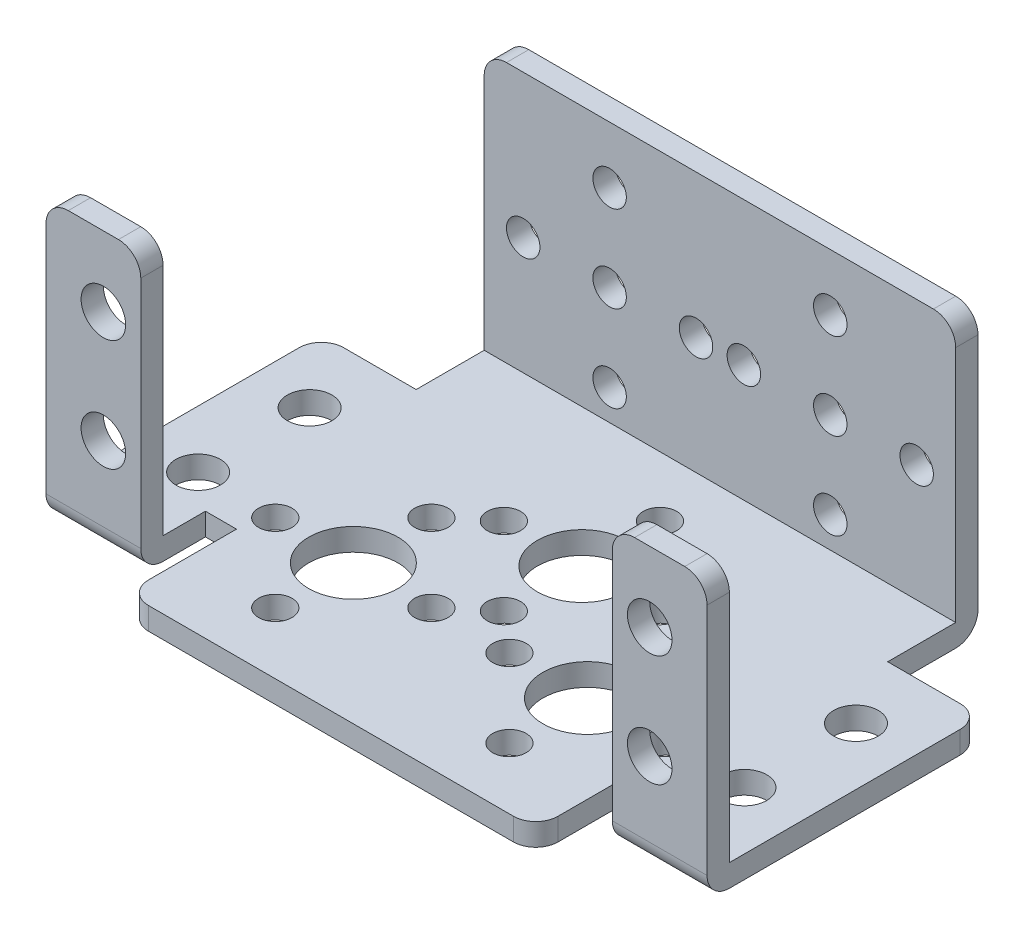
from build123d import *

# Parameters (mm, degrees)
EXTRUDE_1_DEPTH             = 2
EXTRUDE_2_REACH             = 44.559
SKETCH_2_W                  = 2
SKETCH_2_H                  = 23.35
EXTRUDE_2_DIRECTION_2_REACH = 44.559
EXTRUDE_3_DEPTH             = 8.5
CUT_EXTRUDE_1_REACH         = 55.68
SKETCH_4_R                  = 1.5
SKETCH_4_R_2                = 4
SKETCH_4_R_3                = 2
FILLET_1_R                  = 2
CUT_EXTRUDE_2_REACH         = 52.964
SKETCH_5_R                  = 2
SKETCH_6_R                  = 1.5
CUT_EXTRUDE_3_DEPTH         = 53.326503084


with BuildPart() as part:
    # 草图1 → 凸台-拉伸1 (new body)
    with BuildSketch(Plane(origin=(0, 0, 0), x_dir=(1, 0, 0), z_dir=(0, 1, 0))):
        Polygon((21.145, 0), (-21.145, 0), (-21.145, -27), (-18.36, -27), (-18.36, -36.88), (18.36, -36.88), (18.36, -27), (21.145, -27), align=None)
    extrude(amount=EXTRUDE_1_DEPTH)

    # 凸台-拉伸2: up to this face of the body (flat: up to its plane)
    extrude_2_end = Plane(part.part.faces().sort_by_distance((21.145, 1, 13.5))[0])
    # 草图2 → 凸台-拉伸2 (add, up to the picked face)
    with BuildSketch(Plane(origin=(0, 0, 0), x_dir=(0, 0, -1), z_dir=(1, 0, 0)), mode=Mode.PRIVATE) as extrude_2_sk1:
        with Locations((-1, 13.675)):
            Rectangle(SKETCH_2_W, SKETCH_2_H)
    extrude_2_tool1 = split(extrude(extrude_2_sk1.sketch, amount=EXTRUDE_2_REACH, mode=Mode.PRIVATE), bisect_by=extrude_2_end, keep=Keep.BOTH, mode=Mode.PRIVATE)
    add(extrude_2_tool1.solids().sort_by(Axis((0, 13.675, 1), (1, 0, 0)))[0])

    # 凸台-拉伸2 direction 2: up to this face of the body (flat: up to its plane)
    extrude_2_direction_2_end = Plane(part.part.faces().sort_by_distance((-21.145, 1, 13.5))[0])
    # 草图2 → 凸台-拉伸2 direction 2 (add, up to the picked face)
    with BuildSketch(Plane(origin=(0, 0, 0), x_dir=(0, 0, -1), z_dir=(1, 0, 0)), mode=Mode.PRIVATE) as extrude_2_direction_2_sk1:
        with Locations((-1, 13.675)):
            Rectangle(SKETCH_2_W, SKETCH_2_H)
    extrude_2_direction_2_tool1 = split(extrude(extrude_2_direction_2_sk1.sketch, amount=-EXTRUDE_2_DIRECTION_2_REACH, mode=Mode.PRIVATE), bisect_by=extrude_2_direction_2_end, keep=Keep.BOTH, mode=Mode.PRIVATE)
    add(extrude_2_direction_2_tool1.solids().sort_by(Axis((0, 13.675, 1), (-1, 0, 0)))[0])

    # 草图3 → 凸台-拉伸3 (add)
    with BuildSketch(Plane.ZY.offset(21.145)):
        Polygon((32.8, 25), (32.8, 0), (8.1, 0), (8.1, 2), (30.8, 2), (30.8, 25), align=None)
    extrude_3 = extrude(amount=EXTRUDE_3_DEPTH)

    # 镜向1: 凸台-拉伸3 across plane
    add(extrude_3.mirror(Plane(origin=(0, 0, 0), x_dir=(0, 0, 1), z_dir=(1, 0, 0))))

    # 草图4 → 切除-拉伸1 (cut, up to next)
    with BuildSketch(Plane.XZ, mode=Mode.PRIVATE) as cut_extrude_1_sk1:
        with Locations(Location((10.5, 31.38, 0), (0, 0, 270))):
            Circle(SKETCH_4_R)
    cut_extrude_1_tool1 = extrude(cut_extrude_1_sk1.sketch, amount=-CUT_EXTRUDE_1_REACH, mode=Mode.PRIVATE) & part.part
    # 草图4 → 切除-拉伸1 (cut, up to next)
    with BuildSketch(Plane.XZ, mode=Mode.PRIVATE) as cut_extrude_1_sk2:
        with Locations(Location((17.5, 24.38, 0), (0, 0, 270))):
            Circle(SKETCH_4_R)
    cut_extrude_1_tool2 = extrude(cut_extrude_1_sk2.sketch, amount=-CUT_EXTRUDE_1_REACH, mode=Mode.PRIVATE) & part.part
    # 草图4 → 切除-拉伸1 (cut, up to next)
    with BuildSketch(Plane.XZ, mode=Mode.PRIVATE) as cut_extrude_1_sk3:
        with Locations(Location((10.5, 17.38, 0), (0, 0, 270))):
            Circle(SKETCH_4_R)
    cut_extrude_1_tool3 = extrude(cut_extrude_1_sk3.sketch, amount=-CUT_EXTRUDE_1_REACH, mode=Mode.PRIVATE) & part.part
    # 草图4 → 切除-拉伸1 (cut, up to next)
    with BuildSketch(Plane.XZ, mode=Mode.PRIVATE) as cut_extrude_1_sk4:
        with Locations(Location((3.5, 24.38, 0), (0, 0, 270))):
            Circle(SKETCH_4_R)
    cut_extrude_1_tool4 = extrude(cut_extrude_1_sk4.sketch, amount=-CUT_EXTRUDE_1_REACH, mode=Mode.PRIVATE) & part.part
    # 草图4 → 切除-拉伸1 (cut, up to next)
    with BuildSketch(Plane.XZ, mode=Mode.PRIVATE) as cut_extrude_1_sk5:
        with Locations(Location((-17.5, 24.38, 0), (0, 0, 90))):
            Circle(SKETCH_4_R)
    cut_extrude_1_tool5 = extrude(cut_extrude_1_sk5.sketch, amount=-CUT_EXTRUDE_1_REACH, mode=Mode.PRIVATE) & part.part
    # 草图4 → 切除-拉伸1 (cut, up to next)
    with BuildSketch(Plane.XZ, mode=Mode.PRIVATE) as cut_extrude_1_sk6:
        with Locations(Location((-10.5, 17.38, 0), (0, 0, 90))):
            Circle(SKETCH_4_R)
    cut_extrude_1_tool6 = extrude(cut_extrude_1_sk6.sketch, amount=-CUT_EXTRUDE_1_REACH, mode=Mode.PRIVATE) & part.part
    # 草图4 → 切除-拉伸1 (cut, up to next)
    with BuildSketch(Plane.XZ, mode=Mode.PRIVATE) as cut_extrude_1_sk7:
        with Locations(Location((-3.5, 24.38, 0), (0, 0, 90))):
            Circle(SKETCH_4_R)
    cut_extrude_1_tool7 = extrude(cut_extrude_1_sk7.sketch, amount=-CUT_EXTRUDE_1_REACH, mode=Mode.PRIVATE) & part.part
    # 草图4 → 切除-拉伸1 (cut, up to next)
    with BuildSketch(Plane.XZ, mode=Mode.PRIVATE) as cut_extrude_1_sk8:
        with Locations(Location((-10.5, 31.38, 0), (0, 0, 90))):
            Circle(SKETCH_4_R)
    cut_extrude_1_tool8 = extrude(cut_extrude_1_sk8.sketch, amount=-CUT_EXTRUDE_1_REACH, mode=Mode.PRIVATE) & part.part
    # 草图4 → 切除-拉伸1 (cut, up to next)
    with BuildSketch(Plane.XZ, mode=Mode.PRIVATE) as cut_extrude_1_sk9:
        with Locations(Location((0, 21.38, 0), (0, 0, 270))):
            Circle(SKETCH_4_R)
    cut_extrude_1_tool9 = extrude(cut_extrude_1_sk9.sketch, amount=-CUT_EXTRUDE_1_REACH, mode=Mode.PRIVATE) & part.part
    # 草图4 → 切除-拉伸1 (cut, up to next)
    with BuildSketch(Plane.XZ, mode=Mode.PRIVATE) as cut_extrude_1_sk10:
        with Locations(Location((7, 14.38, 0), (0, 0, 270))):
            Circle(SKETCH_4_R)
    cut_extrude_1_tool10 = extrude(cut_extrude_1_sk10.sketch, amount=-CUT_EXTRUDE_1_REACH, mode=Mode.PRIVATE) & part.part
    # 草图4 → 切除-拉伸1 (cut, up to next)
    with BuildSketch(Plane.XZ, mode=Mode.PRIVATE) as cut_extrude_1_sk11:
        with Locations(Location((0, 7.38, 0), (0, 0, 270))):
            Circle(SKETCH_4_R)
    cut_extrude_1_tool11 = extrude(cut_extrude_1_sk11.sketch, amount=-CUT_EXTRUDE_1_REACH, mode=Mode.PRIVATE) & part.part
    # 草图4 → 切除-拉伸1 (cut, up to next)
    with BuildSketch(Plane.XZ, mode=Mode.PRIVATE) as cut_extrude_1_sk12:
        with Locations(Location((-7, 14.38, 0), (0, 0, 270))):
            Circle(SKETCH_4_R)
    cut_extrude_1_tool12 = extrude(cut_extrude_1_sk12.sketch, amount=-CUT_EXTRUDE_1_REACH, mode=Mode.PRIVATE) & part.part
    # 草图4 → 切除-拉伸1 (cut, up to next)
    with BuildSketch(Plane.XZ, mode=Mode.PRIVATE) as cut_extrude_1_sk13:
        with Locations(Location((10.5, 24.38, 0), (0, 0, 270))):
            Circle(SKETCH_4_R_2)
    cut_extrude_1_tool13 = extrude(cut_extrude_1_sk13.sketch, amount=-CUT_EXTRUDE_1_REACH, mode=Mode.PRIVATE) & part.part
    # 草图4 → 切除-拉伸1 (cut, up to next)
    with BuildSketch(Plane.XZ, mode=Mode.PRIVATE) as cut_extrude_1_sk14:
        with Locations(Location((-10.5, 24.38, 0), (0, 0, 90))):
            Circle(SKETCH_4_R_2)
    cut_extrude_1_tool14 = extrude(cut_extrude_1_sk14.sketch, amount=-CUT_EXTRUDE_1_REACH, mode=Mode.PRIVATE) & part.part
    # 草图4 → 切除-拉伸1 (cut, up to next)
    with BuildSketch(Plane.XZ, mode=Mode.PRIVATE) as cut_extrude_1_sk15:
        with Locations(Location((0, 14.38, 0), (0, 0, 270))):
            Circle(SKETCH_4_R_2)
    cut_extrude_1_tool15 = extrude(cut_extrude_1_sk15.sketch, amount=-CUT_EXTRUDE_1_REACH, mode=Mode.PRIVATE) & part.part
    # 草图4 → 切除-拉伸1 (cut, up to next)
    with BuildSketch(Plane.XZ, mode=Mode.PRIVATE) as cut_extrude_1_sk16:
        with Locations(Location((24.5, 24.3, 0), (0, 0, 270))):
            Circle(SKETCH_4_R_3)
    cut_extrude_1_tool16 = extrude(cut_extrude_1_sk16.sketch, amount=-CUT_EXTRUDE_1_REACH, mode=Mode.PRIVATE) & part.part
    # 草图4 → 切除-拉伸1 (cut, up to next)
    with BuildSketch(Plane.XZ, mode=Mode.PRIVATE) as cut_extrude_1_sk17:
        with Locations(Location((24.5, 14.3, 0), (0, 0, 270))):
            Circle(SKETCH_4_R_3)
    cut_extrude_1_tool17 = extrude(cut_extrude_1_sk17.sketch, amount=-CUT_EXTRUDE_1_REACH, mode=Mode.PRIVATE) & part.part
    # 草图4 → 切除-拉伸1 (cut, up to next)
    with BuildSketch(Plane.XZ, mode=Mode.PRIVATE) as cut_extrude_1_sk18:
        with Locations(Location((-24.5, 14.3, 0), (0, 0, 90))):
            Circle(SKETCH_4_R_3)
    cut_extrude_1_tool18 = extrude(cut_extrude_1_sk18.sketch, amount=-CUT_EXTRUDE_1_REACH, mode=Mode.PRIVATE) & part.part
    # 草图4 → 切除-拉伸1 (cut, up to next)
    with BuildSketch(Plane.XZ, mode=Mode.PRIVATE) as cut_extrude_1_sk19:
        with Locations(Location((-24.5, 24.3, 0), (0, 0, 90))):
            Circle(SKETCH_4_R_3)
    cut_extrude_1_tool19 = extrude(cut_extrude_1_sk19.sketch, amount=-CUT_EXTRUDE_1_REACH, mode=Mode.PRIVATE) & part.part
    add(cut_extrude_1_tool1.solids().sort_by_distance((10.5, 0, 31.38))[0], mode=Mode.SUBTRACT)
    add(cut_extrude_1_tool2.solids().sort_by_distance((17.5, 0, 24.38))[0], mode=Mode.SUBTRACT)
    add(cut_extrude_1_tool3.solids().sort_by_distance((10.5, 0, 17.38))[0], mode=Mode.SUBTRACT)
    add(cut_extrude_1_tool4.solids().sort_by_distance((3.5, 0, 24.38))[0], mode=Mode.SUBTRACT)
    add(cut_extrude_1_tool5.solids().sort_by_distance((-17.5, 0, 24.38))[0], mode=Mode.SUBTRACT)
    add(cut_extrude_1_tool6.solids().sort_by_distance((-10.5, 0, 17.38))[0], mode=Mode.SUBTRACT)
    add(cut_extrude_1_tool7.solids().sort_by_distance((-3.5, 0, 24.38))[0], mode=Mode.SUBTRACT)
    add(cut_extrude_1_tool8.solids().sort_by_distance((-10.5, 0, 31.38))[0], mode=Mode.SUBTRACT)
    add(cut_extrude_1_tool9.solids().sort_by_distance((0, 0, 21.38))[0], mode=Mode.SUBTRACT)
    add(cut_extrude_1_tool10.solids().sort_by_distance((7, 0, 14.38))[0], mode=Mode.SUBTRACT)
    add(cut_extrude_1_tool11.solids().sort_by_distance((0, 0, 7.38))[0], mode=Mode.SUBTRACT)
    add(cut_extrude_1_tool12.solids().sort_by_distance((-7, 0, 14.38))[0], mode=Mode.SUBTRACT)
    add(cut_extrude_1_tool13.solids().sort_by_distance((10.5, 0, 24.38))[0], mode=Mode.SUBTRACT)
    add(cut_extrude_1_tool14.solids().sort_by_distance((-10.5, 0, 24.38))[0], mode=Mode.SUBTRACT)
    add(cut_extrude_1_tool15.solids().sort_by_distance((0, 0, 14.38))[0], mode=Mode.SUBTRACT)
    add(cut_extrude_1_tool16.solids().sort_by_distance((24.5, 0, 24.3))[0], mode=Mode.SUBTRACT)
    add(cut_extrude_1_tool17.solids().sort_by_distance((24.5, 0, 14.3))[0], mode=Mode.SUBTRACT)
    add(cut_extrude_1_tool18.solids().sort_by_distance((-24.5, 0, 14.3))[0], mode=Mode.SUBTRACT)
    add(cut_extrude_1_tool19.solids().sort_by_distance((-24.5, 0, 24.3))[0], mode=Mode.SUBTRACT)

    # 圆角1
    fillet_1_edges = [part.edges().sort_by_distance(p)[0] for p in [
        (25.395, 0, 32.8),
        (-25.395, 0, 32.8),
        (-18.36, 1, 36.88),
        (18.36, 1, 36.88),
        (-29.645, 25, 31.8),
        (29.645, 25, 31.8),
        (21.145, 25.35, 1),
        (-21.145, 25.35, 1),
        (-29.645, 1, 8.1),
        (29.645, 1, 8.1),
        (0, 0, 0),
        (-21.145, 25, 31.8),
        (21.145, 25, 31.8),
    ]]
    fillet(fillet_1_edges, radius=FILLET_1_R)

    # 草图5 → 切除-拉伸2 (cut, up to next)
    with BuildSketch(Plane.XY.offset(32.8), mode=Mode.PRIVATE) as cut_extrude_2_sk1:
        with Locations((-24.5, 18.7)):
            Circle(SKETCH_5_R)
    cut_extrude_2_tool1 = extrude(cut_extrude_2_sk1.sketch, amount=-CUT_EXTRUDE_2_REACH, mode=Mode.PRIVATE) & part.part
    # 草图5 → 切除-拉伸2 (cut, up to next)
    with BuildSketch(Plane.XY.offset(32.8), mode=Mode.PRIVATE) as cut_extrude_2_sk2:
        with Locations((-24.5, 8.7)):
            Circle(SKETCH_5_R)
    cut_extrude_2_tool2 = extrude(cut_extrude_2_sk2.sketch, amount=-CUT_EXTRUDE_2_REACH, mode=Mode.PRIVATE) & part.part
    # 草图5 → 切除-拉伸2 (cut, up to next)
    with BuildSketch(Plane.XY.offset(32.8), mode=Mode.PRIVATE) as cut_extrude_2_sk3:
        with Locations(Location((24.5, 8.7, 0), (0, 0, 180))):
            Circle(SKETCH_5_R)
    cut_extrude_2_tool3 = extrude(cut_extrude_2_sk3.sketch, amount=-CUT_EXTRUDE_2_REACH, mode=Mode.PRIVATE) & part.part
    # 草图5 → 切除-拉伸2 (cut, up to next)
    with BuildSketch(Plane.XY.offset(32.8), mode=Mode.PRIVATE) as cut_extrude_2_sk4:
        with Locations(Location((24.5, 18.7, 0), (0, 0, 180))):
            Circle(SKETCH_5_R)
    cut_extrude_2_tool4 = extrude(cut_extrude_2_sk4.sketch, amount=-CUT_EXTRUDE_2_REACH, mode=Mode.PRIVATE) & part.part
    add(cut_extrude_2_tool1.solids().sort_by_distance((-24.5, 18.7, 32.8))[0], mode=Mode.SUBTRACT)
    add(cut_extrude_2_tool2.solids().sort_by_distance((-24.5, 8.7, 32.8))[0], mode=Mode.SUBTRACT)
    add(cut_extrude_2_tool3.solids().sort_by_distance((24.5, 8.7, 32.8))[0], mode=Mode.SUBTRACT)
    add(cut_extrude_2_tool4.solids().sort_by_distance((24.5, 18.7, 32.8))[0], mode=Mode.SUBTRACT)

    # 草图6 → 切除-拉伸3 (cut, through all)
    with BuildSketch(Plane.XY.offset(2)):
        with Locations((-9.895, 12.5)):
            Circle(SKETCH_6_R)
        with Locations((-17.645, 12.5)):
            Circle(SKETCH_6_R)
        with Locations((-9.895, 20.25)):
            Circle(SKETCH_6_R)
        with Locations((-2.145, 12.5)):
            Circle(SKETCH_6_R)
        with Locations((-9.895, 4.75)):
            Circle(SKETCH_6_R)
        with Locations(Location((9.895, 4.75, 0), (0, 0, 180))):
            Circle(SKETCH_6_R)
        with Locations(Location((9.895, 12.5, 0), (0, 0, 180))):
            Circle(SKETCH_6_R)
        with Locations(Location((2.145, 12.5, 0), (0, 0, 180))):
            Circle(SKETCH_6_R)
        with Locations(Location((9.895, 20.25, 0), (0, 0, 180))):
            Circle(SKETCH_6_R)
        with Locations(Location((17.645, 12.5, 0), (0, 0, 180))):
            Circle(SKETCH_6_R)
    extrude(amount=-CUT_EXTRUDE_3_DEPTH, mode=Mode.SUBTRACT)


solid = part.part
